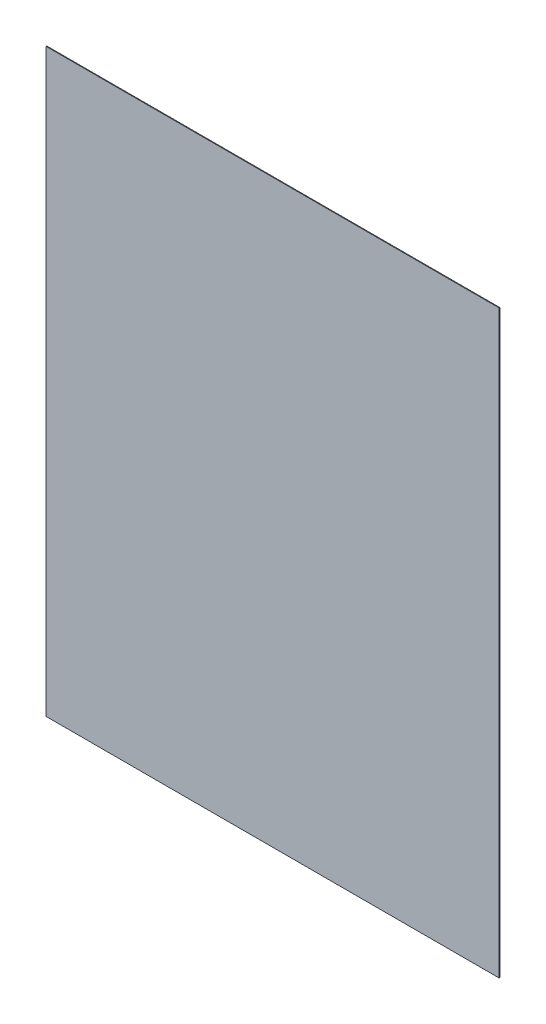
from build123d import *

# Parameters (mm, degrees)
CROQUIS1_W              = 647.79
CROQUIS1_H              = 830
SALIENTE_EXTRUIR1_DEPTH = 1


with BuildPart() as part:
    # Croquis1 → Saliente-Extruir1 (new body)
    with BuildSketch(Plane.XY):
        Rectangle(CROQUIS1_W, CROQUIS1_H)
    extrude(amount=SALIENTE_EXTRUIR1_DEPTH)


solid = part.part
